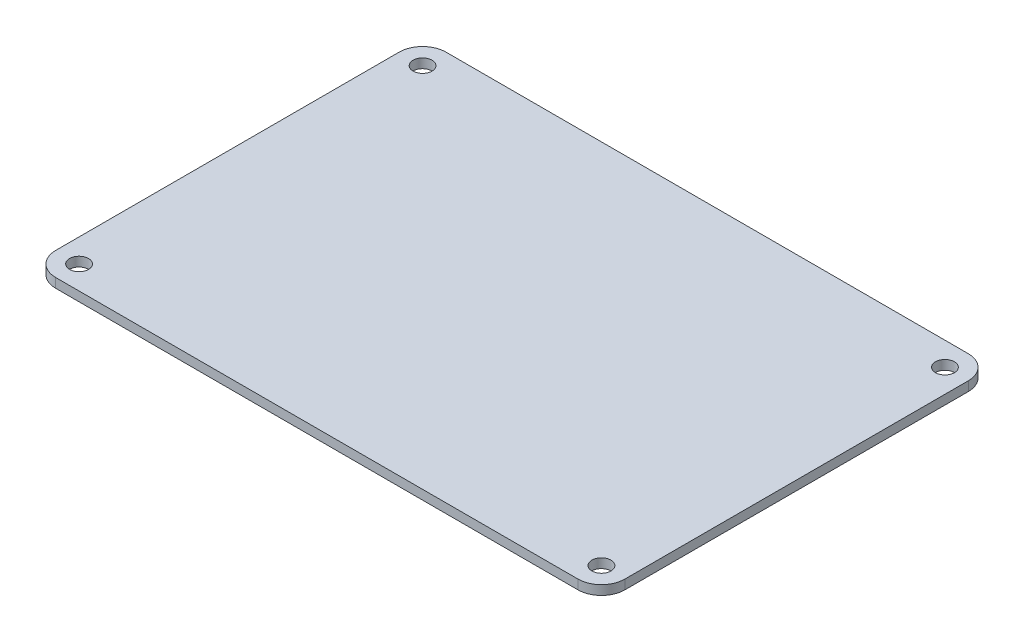
from build123d import *

# Parameters (mm, degrees)
BOSS_EXTRUDE3_DEPTH = 2
BOSS_EXTRUDE4_DEPTH = 2
BOSS_EXTRUDE5_DEPTH = 2
CUT_EXTRUDE21_DEPTH = 10
SKETCH7_W           = 2.5
SKETCH7_H           = 2.5
CUT_EXTRUDE23_DEPTH = 1
SKETCH8_W           = 22.1023805
SKETCH8_H           = 14.934040877
BOSS_EXTRUDE6_DEPTH = 1


with BuildPart() as part:
    # Sketch1 → Boss-Extrude3 (new body)
    with BuildSketch(Plane(origin=(0, 0, 0), x_dir=(1, 0, 0), z_dir=(0, 1, 0))):
        with BuildLine():
            Line((58.25, 0), (58.25, 36.66))
            ThreePointArc((58.25, 36.66), (53.982233047, 34.892233047), (55.75, 39.16))
            Line((55.75, 39.16), (0, 39.16))
            ThreePointArc((0, 39.16), (1.767766953, 34.892233047), (-2.5, 36.66))
            Line((-2.5, 36.66), (-2.5, 0))
            ThreePointArc((-2.5, 0), (1.767766953, 1.767766953), (0, -2.5))
            Line((0, -2.5), (55.75, -2.5))
            ThreePointArc((55.75, -2.5), (53.982233047, 1.767766953), (58.25, 0))
        make_face()
    extrude(amount=BOSS_EXTRUDE3_DEPTH)

    # Sketch1<5> → Boss-Extrude4 (add)
    with BuildSketch(Plane(origin=(0, 0, 0), x_dir=(1, 0, 0), z_dir=(0, 1, 0))):
        with BuildLine():
            ThreePointArc((55.75, -2.5), (57.517766953, -1.767766953), (58.25, 0))
            Line((58.25, 0), (56.762, 0))
            ThreePointArc((56.762, 0), (56.465592063, -0.715592063), (55.75, -1.012))
            Line((55.75, -1.012), (55.75, -2.5))
        make_face()
        with BuildLine():
            Line((55.75, 1.012), (55.75, 2.5))
            ThreePointArc((55.75, 2.5), (53.982233047, 1.767766953), (53.25, 0))
            Line((53.25, 0), (54.738, 0))
            ThreePointArc((54.738, 0), (55.034407937, 0.715592063), (55.75, 1.012))
        make_face()
        with BuildLine():
            ThreePointArc((53.25, 0), (53.982233047, -1.767766953), (55.75, -2.5))
            Line((55.75, -2.5), (55.75, -1.012))
            ThreePointArc((55.75, -1.012), (55.034407937, -0.715592063), (54.738, 0))
            Line((54.738, 0), (53.25, 0))
        make_face()
        with BuildLine():
            Line((56.762, 0), (58.25, 0))
            ThreePointArc((58.25, 0), (57.517766953, 1.767766953), (55.75, 2.5))
            Line((55.75, 2.5), (55.75, 1.012))
            ThreePointArc((55.75, 1.012), (56.465592063, 0.715592063), (56.762, 0))
        make_face()
    extrude(amount=BOSS_EXTRUDE4_DEPTH)

    # Sketch1<6> → Boss-Extrude5 (add)
    with BuildSketch(Plane(origin=(0, 0, 0), x_dir=(1, 0, 0), z_dir=(0, 1, 0))):
        with BuildLine():
            ThreePointArc((-2.5, 0), (-1.767766953, -1.767766953), (0, -2.5))
            Line((0, -2.5), (0, -1.012))
            ThreePointArc((0, -1.012), (-0.715592063, -0.715592063), (-1.012, 0))
            Line((-1.012, 0), (-2.5, 0))
        make_face()
        with BuildLine():
            Line((0, 1.012), (0, 2.5))
            ThreePointArc((0, 2.5), (-1.767766953, 1.767766953), (-2.5, 0))
            Line((-2.5, 0), (-1.012, 0))
            ThreePointArc((-1.012, 0), (-0.715592063, 0.715592063), (0, 1.012))
        make_face()
        with BuildLine():
            ThreePointArc((2.5, 0), (1.767766953, 1.767766953), (0, 2.5))
            Line((0, 2.5), (0, 1.012))
            ThreePointArc((0, 1.012), (0.715592063, 0.715592063), (1.012, 0))
            Line((1.012, 0), (2.5, 0))
        make_face()
        with BuildLine():
            Line((0, -1.012), (0, -2.5))
            ThreePointArc((0, -2.5), (1.767766953, -1.767766953), (2.5, 0))
            Line((2.5, 0), (1.012, 0))
            ThreePointArc((1.012, 0), (0.715592063, -0.715592063), (0, -1.012))
        make_face()
        with BuildLine():
            ThreePointArc((-2.5, 36.66), (-1.767766953, 34.892233047), (0, 34.16))
            Line((0, 34.16), (0, 35.648))
            ThreePointArc((0, 35.648), (-0.715592063, 35.944407937), (-1.012, 36.66))
            Line((-1.012, 36.66), (-2.5, 36.66))
        make_face()
        with BuildLine():
            Line((0, 37.672), (0, 39.16))
            ThreePointArc((0, 39.16), (-1.767766953, 38.427766953), (-2.5, 36.66))
            Line((-2.5, 36.66), (-1.012, 36.66))
            ThreePointArc((-1.012, 36.66), (-0.715592063, 37.375592063), (0, 37.672))
        make_face()
        with BuildLine():
            Line((1.012, 36.66), (2.5, 36.66))
            ThreePointArc((2.5, 36.66), (1.767766953, 38.427766953), (0, 39.16))
            Line((0, 39.16), (0, 37.672))
            ThreePointArc((0, 37.672), (0.715592063, 37.375592063), (1.012, 36.66))
        make_face()
        with BuildLine():
            ThreePointArc((0, 34.16), (1.767766953, 34.892233047), (2.5, 36.66))
            Line((2.5, 36.66), (1.012, 36.66))
            ThreePointArc((1.012, 36.66), (0.715592063, 35.944407937), (0, 35.648))
            Line((0, 35.648), (0, 34.16))
        make_face()
        with BuildLine():
            ThreePointArc((55.75, 35.648), (55.034407937, 35.944407937), (54.738, 36.66))
            Line((54.738, 36.66), (53.25, 36.66))
            ThreePointArc((53.25, 36.66), (53.982233047, 34.892233047), (55.75, 34.16))
            Line((55.75, 34.16), (55.75, 35.648))
        make_face()
        with BuildLine():
            Line((53.25, 36.66), (54.738, 36.66))
            ThreePointArc((54.738, 36.66), (55.034407937, 37.375592063), (55.75, 37.672))
            Line((55.75, 37.672), (55.75, 39.16))
            ThreePointArc((55.75, 39.16), (53.982233047, 38.427766953), (53.25, 36.66))
        make_face()
        with BuildLine():
            ThreePointArc((55.75, 37.672), (56.465592063, 37.375592063), (56.762, 36.66))
            Line((56.762, 36.66), (58.25, 36.66))
            ThreePointArc((58.25, 36.66), (57.517766953, 38.427766953), (55.75, 39.16))
            Line((55.75, 39.16), (55.75, 37.672))
        make_face()
        with BuildLine():
            Line((58.25, 36.66), (56.762, 36.66))
            ThreePointArc((56.762, 36.66), (56.465592063, 35.944407937), (55.75, 35.648))
            Line((55.75, 35.648), (55.75, 34.16))
            ThreePointArc((55.75, 34.16), (57.517766953, 34.892233047), (58.25, 36.66))
        make_face()
    extrude(amount=BOSS_EXTRUDE5_DEPTH)

    # Sketch2 → Cut-Extrude21 (cut)
    with BuildSketch(Plane(origin=(0, 2, 0), x_dir=(1, 0, 0), z_dir=(0, 1, 0))):
        with BuildLine():
            Line((33.435800302, 28.16), (33.925, 28.16))
            Line((33.925, 28.16), (33.925, 30.16))
            Line((33.925, 30.16), (33.435800302, 30.16))
            ThreePointArc((33.435800302, 30.16), (27.875, 34.81), (22.314199698, 30.16))
            Line((22.314199698, 30.16), (21.825, 30.16))
            Line((21.825, 30.16), (21.825, 28.16))
            Line((21.825, 28.16), (22.314199698, 28.16))
            ThreePointArc((22.314199698, 28.16), (27.875, 23.51), (33.435800302, 28.16))
        make_face()
    extrude(amount=-CUT_EXTRUDE21_DEPTH, mode=Mode.SUBTRACT)

    # Sketch7 → Cut-Extrude23 (cut)
    with BuildSketch(Plane(origin=(0, 2, 0), x_dir=(1, 0, 0), z_dir=(0, 1, 0))):
        with Locations((57, -1.25)):
            Rectangle(SKETCH7_W, SKETCH7_H)
        Polygon((-2.5, -2.5), (55.75, -2.5), (55.75, 0), (58.25, 0), (58.25, 39.16), (0, 39.16), (0, 36.66), (-2.5, 36.66), align=None)
        with Locations((-1.25, 37.91)):
            Rectangle(SKETCH7_W, SKETCH7_H)
    extrude(amount=-CUT_EXTRUDE23_DEPTH, mode=Mode.SUBTRACT)

    # Sketch8 → Boss-Extrude6 (add)
    with BuildSketch(Plane(origin=(0, 1, 0), x_dir=(1, 0, 0), z_dir=(0, 1, 0))):
        with Locations((28.465364517, 28.71396685)):
            Rectangle(SKETCH8_W, SKETCH8_H)
    extrude(amount=-BOSS_EXTRUDE6_DEPTH)


solid = part.part
